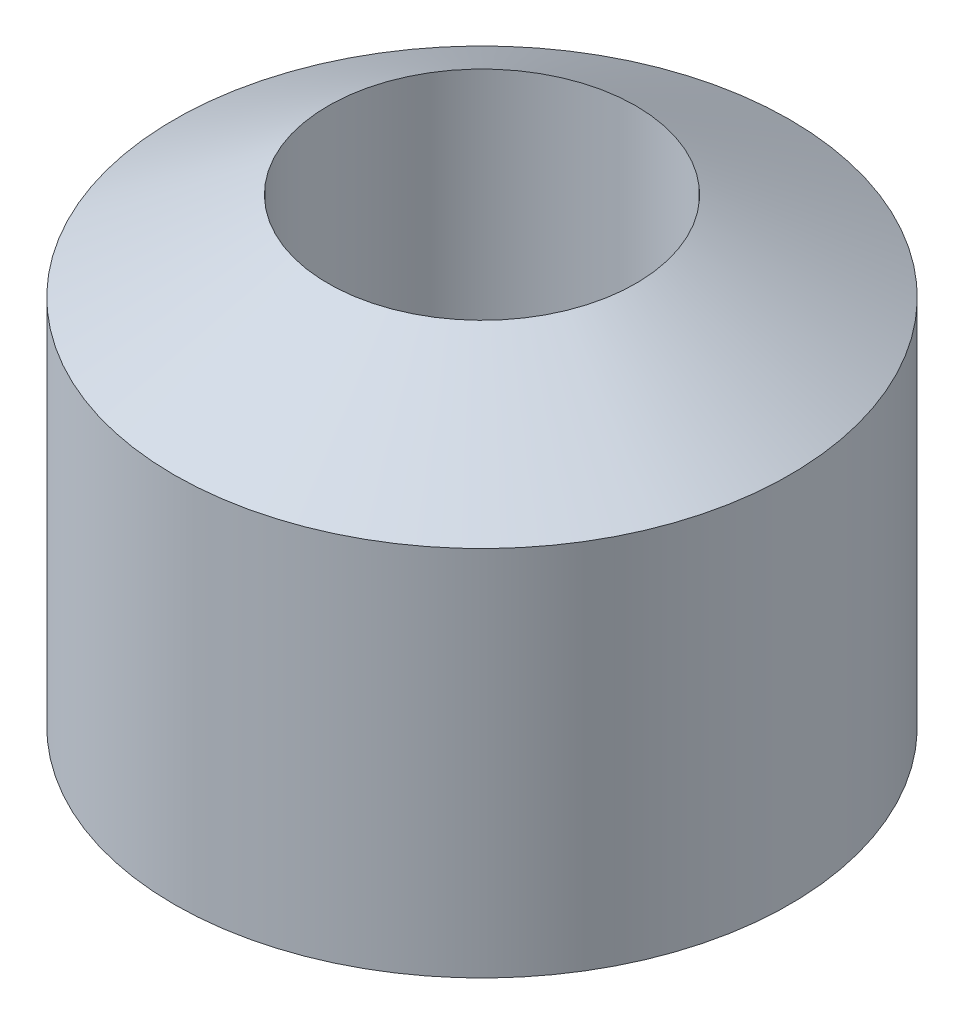
from build123d import *


with BuildPart() as part:
    # Sketch1 → Revolve1 (revolve)
    with BuildSketch(Plane.XY, mode=Mode.PRIVATE) as revolve1_sk:
        Polygon((14, 50), (14, 0), (28, 8.082903769), (28, 41.917096231), align=None)
    revolve(revolve1_sk.sketch.rotate(Axis((0, 0, 0), (0, 1, 0)), 90), axis=Axis((0, 0, 0), (0, 1, 0)))


solid = part.part
